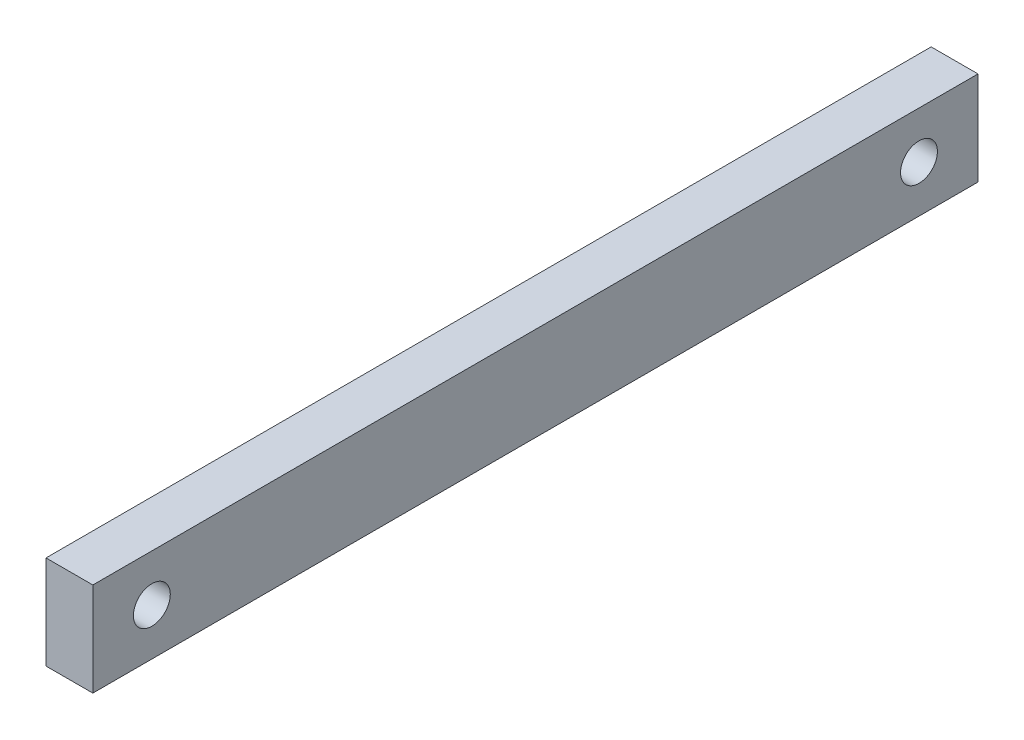
from build123d import *

# Parameters (mm, degrees)
BOSS_EXTRUDE1_DEPTH      = 60
BOSS_EXTRUDE1_DEPTH_BACK = 60
SKETCH2_W                = 6.35
SKETCH2_H                = 12.7
SKETCH4_R                = 2.5
CUT_EXTRUDE1_DEPTH       = 61.668319575


with BuildPart() as part:
    # Sketch2 → Boss-Extrude1 (new, two sides: drawn at the far end of the back side and taken through both)
    with BuildSketch(Plane.XY.offset(-BOSS_EXTRUDE1_DEPTH_BACK)):
        Rectangle(SKETCH2_W, SKETCH2_H)
    extrude(amount=BOSS_EXTRUDE1_DEPTH + BOSS_EXTRUDE1_DEPTH_BACK)

    # Sketch4 → Cut-Extrude1 (cut, through all)
    with BuildSketch(Plane(origin=(3.175, 0, 0), x_dir=(0, 0, -1), z_dir=(1, 0, 0))):
        with Locations((-52, 0)):
            Circle(SKETCH4_R)
        with Locations((52, 0)):
            Circle(SKETCH4_R)
    extrude(amount=-CUT_EXTRUDE1_DEPTH, mode=Mode.SUBTRACT)


solid = part.part
